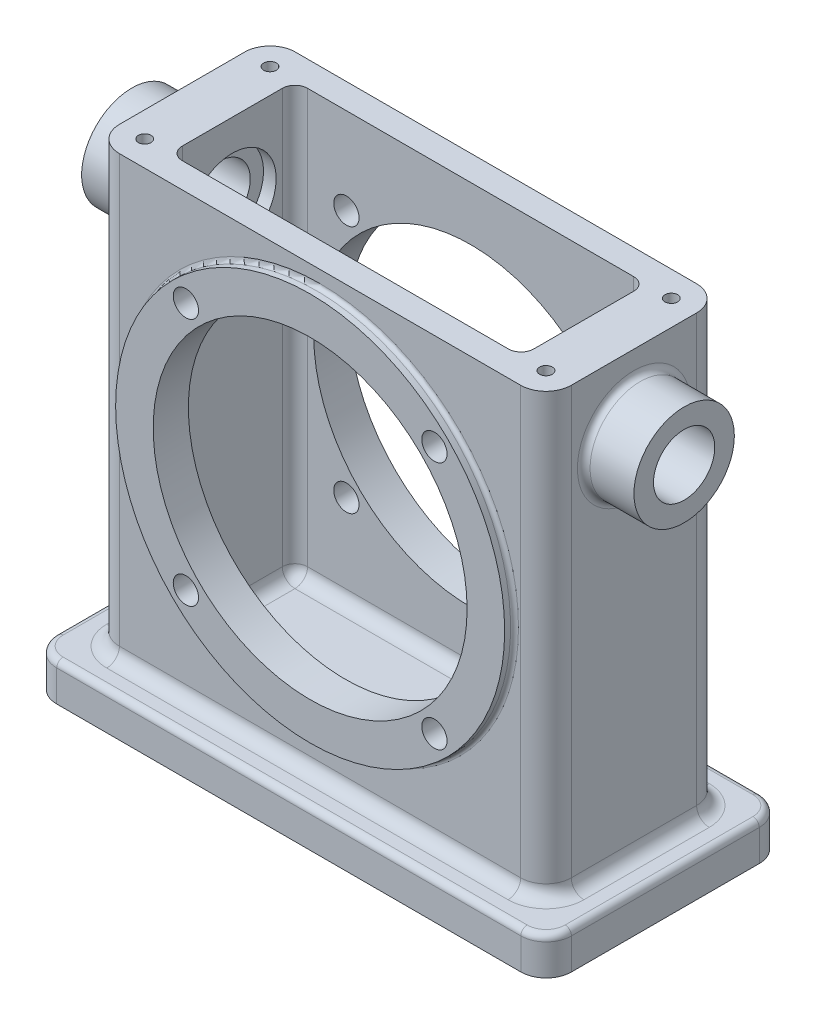
from build123d import *

# Parameters (mm, degrees)
SKETCH1_W           = 130.2
SKETCH1_H           = 60.3
BASE_EXTRUDE_DEPTH  = 9.5
SKETCH2_W           = 114.3
SKETCH2_H           = 44.5
BOSS_EXTRUDE1_DEPTH = 111.1
FILLET1_R           = 6.4
FILLET2_R           = 1.6
FILLET3_R           = 3.2
CUT_EXTRUDE1_DEPTH  = 108
FILLET4_R           = 3.2
SKETCH4_R           = 49.2
BOSS_EXTRUDE2_DEPTH = 2.5
SKETCH5_R           = 39.7
CUT_EXTRUDE2_DEPTH  = 148.635971271
FILLET5_R           = 1
SKETCH6_R           = 12.7
BOSS_EXTRUDE3_DEPTH = 12.7
SKETCH7_R           = 7.75
CUT_EXTRUDE3_DEPTH  = 166.694251626
SKETCH8_R           = 11.1
CUT_EXTRUDE4_DEPTH  = 3.2
FILLET6_R           = 1.6
SKETCH9_R           = 3.2
CUT_EXTRUDE5_DEPTH  = 150.791162957
CIRPATTERN1_COUNT   = 4
SKETCH10_R          = 1.6
CUT_EXTRUDE6_DEPTH  = 19.1


with BuildPart() as part:
    # Sketch1 → Base-Extrude (new body)
    with BuildSketch(Plane(origin=(0, 0, 0), x_dir=(1, 0, 0), z_dir=(0, 1, 0))):
        Rectangle(SKETCH1_W, SKETCH1_H)
    extrude(amount=BASE_EXTRUDE_DEPTH)

    # Sketch2 → Boss-Extrude1 (add)
    with BuildSketch(Plane(origin=(0, 9.5, 0), x_dir=(-1, 0, 0), z_dir=(0, 1, 0))):
        Rectangle(SKETCH2_W, SKETCH2_H)
    extrude(amount=BOSS_EXTRUDE1_DEPTH)

    # Fillet1
    fillet1_edges = [part.edges().sort_by_distance(p)[0] for p in [
        (-57.15, 65.05, -22.25),
        (-57.15, 65.05, 22.25),
        (57.15, 65.05, 22.25),
        (57.15, 65.05, -22.25),
        (-65.1, 4.75, -30.15),
        (65.1, 4.75, -30.15),
        (65.1, 4.75, 30.15),
        (-65.1, 4.75, 30.15),
    ]]
    fillet(fillet1_edges, radius=FILLET1_R)

    # Fillet2
    fillet2_edges = [part.edges().sort_by_distance(p)[0] for p in [
        (0, 9.5, 30.15),
        (-65.1, 9.5, 0),
        (65.1, 9.5, 0),
        (0, 9.5, -30.15),
        (-63.2254834, 9.5, -28.2754834),
        (63.2254834, 9.5, 28.2754834),
        (63.2254834, 9.5, -28.2754834),
        (-63.2254834, 9.5, 28.2754834),
    ]]
    fillet(fillet2_edges, radius=FILLET2_R)

    # Fillet3
    fillet3_edges = [part.edges().sort_by_distance(p)[0] for p in [
        (-57.15, 9.5, 0),
        (0, 9.5, -22.25),
        (57.15, 9.5, 0),
        (0, 9.5, 22.25),
        (-55.2754834, 9.5, 20.3754834),
        (-55.2754834, 9.5, -20.3754834),
        (55.2754834, 9.5, 20.3754834),
        (55.2754834, 9.5, -20.3754834),
    ]]
    fillet(fillet3_edges, radius=FILLET3_R)

    # Sketch3 → Cut-Extrude1 (cut)
    with BuildSketch(Plane(origin=(0, 120.6, 0), x_dir=(-1, 0, 0), z_dir=(0, 1, 0))):
        with BuildLine():
            Line((41.25, 15.85), (-41.25, 15.85))
            ThreePointArc((-41.25, 15.85), (-43.5127417, 14.9127417), (-44.45, 12.65))
            Line((-44.45, 12.65), (-44.45, -12.65))
            ThreePointArc((-44.45, -12.65), (-43.5127417, -14.9127417), (-41.25, -15.85))
            Line((-41.25, -15.85), (41.25, -15.85))
            ThreePointArc((41.25, -15.85), (43.5127417, -14.9127417), (44.45, -12.65))
            Line((44.45, -12.65), (44.45, 12.65))
            ThreePointArc((44.45, 12.65), (43.5127417, 14.9127417), (41.25, 15.85))
        make_face()
    extrude(amount=-CUT_EXTRUDE1_DEPTH, mode=Mode.SUBTRACT)

    # Fillet4
    fillet4_edges = [part.edges().sort_by_distance(p)[0] for p in [
        (43.5127417, 12.6, 14.9127417),
        (0, 12.6, 15.85),
        (-43.5127417, 12.6, 14.9127417),
        (-44.45, 12.6, 0),
        (-43.5127417, 12.6, -14.9127417),
        (0, 12.6, -15.85),
        (43.5127417, 12.6, -14.9127417),
        (44.45, 12.6, 0),
    ]]
    fillet(fillet4_edges, radius=FILLET4_R)

    # Sketch4 → Boss-Extrude2 (add)
    with BuildSketch(Plane.XY.offset(22.25)):
        with Locations(Location((0, 67.3, 0), (0, 0, 180))):
            Circle(SKETCH4_R)
    boss_extrude2 = extrude(amount=BOSS_EXTRUDE2_DEPTH)

    # Mirror1: Boss-Extrude2 across plane
    add(boss_extrude2.mirror(Plane.XY))

    # Sketch5 → Cut-Extrude2 (cut, through all)
    with BuildSketch(Plane.XY.offset(24.75)):
        with Locations(Location((0, 67.3, 0), (0, 0, 180))):
            Circle(SKETCH5_R)
    extrude(amount=-CUT_EXTRUDE2_DEPTH, mode=Mode.SUBTRACT)

    # Fillet5
    fillet5_edges = [part.edges().sort_by_distance(p)[0] for p in [
        (49.2, 67.3, 22.25),
        (49.2, 67.3, -22.25),
    ]]
    fillet(fillet5_edges, radius=FILLET5_R)

    # Sketch6 → Boss-Extrude3 (add)
    with BuildSketch(Plane(origin=(57.15, 0, 0), x_dir=(0, 0, -1), z_dir=(1, 0, 0))):
        with Locations(Location((0, 101.6, 0), (0, 0, 180))):
            Circle(SKETCH6_R)
    boss_extrude3 = extrude(amount=BOSS_EXTRUDE3_DEPTH)

    # Sketch7 → Cut-Extrude3 (cut, through all)
    with BuildSketch(Plane.ZY.offset(-44.45)):
        with Locations((0, 101.6)):
            Circle(SKETCH7_R)
    cut_extrude3 = extrude(amount=-CUT_EXTRUDE3_DEPTH, mode=Mode.SUBTRACT)

    # Sketch8 → Cut-Extrude4 (cut)
    with BuildSketch(Plane.ZY.offset(-44.45)):
        with Locations((0, 101.6)):
            Circle(SKETCH8_R)
    cut_extrude4 = extrude(amount=-CUT_EXTRUDE4_DEPTH, mode=Mode.SUBTRACT)

    # Mirror3: Boss-Extrude3, Cut-Extrude3, Cut-Extrude4 across plane
    add(boss_extrude3.mirror(Plane(origin=(0, 0, 0), x_dir=(0, 0, 1), z_dir=(1, 0, 0))))
    add(cut_extrude3.mirror(Plane(origin=(0, 0, 0), x_dir=(0, 0, 1), z_dir=(1, 0, 0))), mode=Mode.SUBTRACT)
    add(cut_extrude4.mirror(Plane(origin=(0, 0, 0), x_dir=(0, 0, 1), z_dir=(1, 0, 0))), mode=Mode.SUBTRACT)

    # Fillet6
    fillet6_edges = [part.edges().sort_by_distance(p)[0] for p in [
        (57.15, 101.6, -12.7),
        (-57.15, 101.6, -12.7),
    ]]
    fillet(fillet6_edges, radius=FILLET6_R)

    # Sketch9 → Cut-Extrude5 (cut, through all)
    with BuildSketch(Plane.XY.offset(24.75)):
        with Locations(Location((31.430896424, 98.730896424, 0), (0, 0, 180))):
            Circle(SKETCH9_R)
    cut_extrude5 = extrude(amount=-CUT_EXTRUDE5_DEPTH, mode=Mode.SUBTRACT)

    # CirPattern1: Cut-Extrude5 ×4 about axis
    cirpattern1_axis = Axis((0, 67.3, 0), (0, 0, 1))
    for i in range(1, CIRPATTERN1_COUNT):
        add(cut_extrude5.rotate(cirpattern1_axis, i * 360 / CIRPATTERN1_COUNT), mode=Mode.SUBTRACT)

    # Sketch10 → Cut-Extrude6 (cut)
    with BuildSketch(Plane(origin=(0, 120.6, 0), x_dir=(-1, 0, 0), z_dir=(0, 1, 0))):
        with Locations(Location((-50.75, -15.85, 0), (0, 0, 90))):
            Circle(SKETCH10_R)
        with Locations(Location((-50.75, 15.85, 0), (0, 0, 90))):
            Circle(SKETCH10_R)
    cut_extrude6 = extrude(amount=-CUT_EXTRUDE6_DEPTH, mode=Mode.SUBTRACT)

    # Mirror4: Cut-Extrude6 across plane
    add(cut_extrude6.mirror(Plane(origin=(0, 0, 0), x_dir=(0, 0, 1), z_dir=(1, 0, 0))), mode=Mode.SUBTRACT)


solid = part.part
